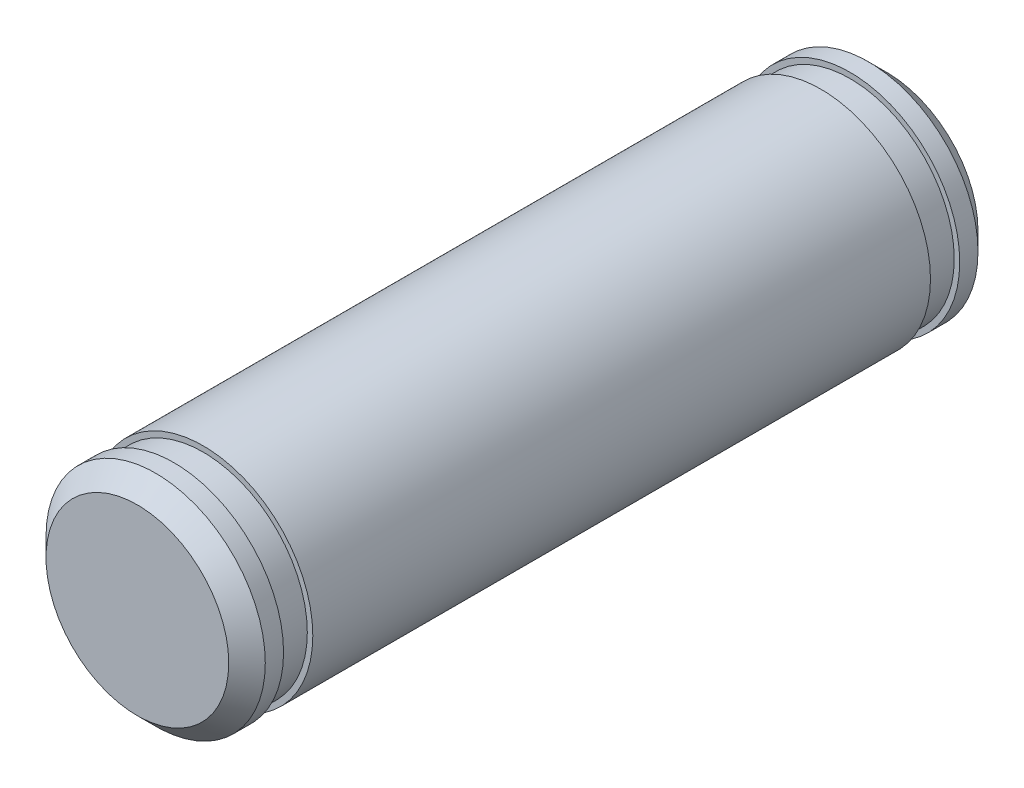
from build123d import *

# Parameters (mm, degrees)
SZKIC1_R                    = 3
DODANIE_WYCI_GNI_CIE1_DEPTH = 20.5
WYTNIJ_WYCI_GNI_CIE1_START  = -1.8
SZKIC2_R                    = 3
SZKIC2_R_2                  = 2.85
WYTNIJ_WYCI_GNI_CIE1_DEPTH  = 0.8
WYTNIJ_WYCI_GNI_CIE2_START  = -19.5
SZKIC2_2_R                  = 3
SZKIC2_2_R_2                = 2.85
WYTNIJ_WYCI_GNI_CIE2_DEPTH  = 0.8
SFAZOWANIE1_SIZE            = 0.5


with BuildPart() as part:
    # Szkic1 → Dodanie-wyciągnięcie1 (new body)
    with BuildSketch(Plane.XY):
        Circle(SZKIC1_R)
    extrude(amount=DODANIE_WYCI_GNI_CIE1_DEPTH)

    # Szkic2 → Wytnij-wyciągnięcie1 (cut)
    with BuildSketch(Plane.XY.offset(20.5).offset(WYTNIJ_WYCI_GNI_CIE1_START)):
        Circle(SZKIC2_R)
        Circle(SZKIC2_R_2, mode=Mode.SUBTRACT)
    extrude(amount=WYTNIJ_WYCI_GNI_CIE1_DEPTH, mode=Mode.SUBTRACT)

    # Szkic2<2> → Wytnij-wyciągnięcie2 (cut)
    with BuildSketch(Plane.XY.offset(20.5).offset(WYTNIJ_WYCI_GNI_CIE2_START)):
        Circle(SZKIC2_2_R)
        Circle(SZKIC2_2_R_2, mode=Mode.SUBTRACT)
    extrude(amount=WYTNIJ_WYCI_GNI_CIE2_DEPTH, mode=Mode.SUBTRACT)

    # Sfazowanie1
    sfazowanie1_edges = [part.edges().sort_by_distance(p)[0] for p in [
        (-3, 0, 0),
        (-3, 0, 20.5),
    ]]
    chamfer(sfazowanie1_edges, length=SFAZOWANIE1_SIZE)


solid = part.part
